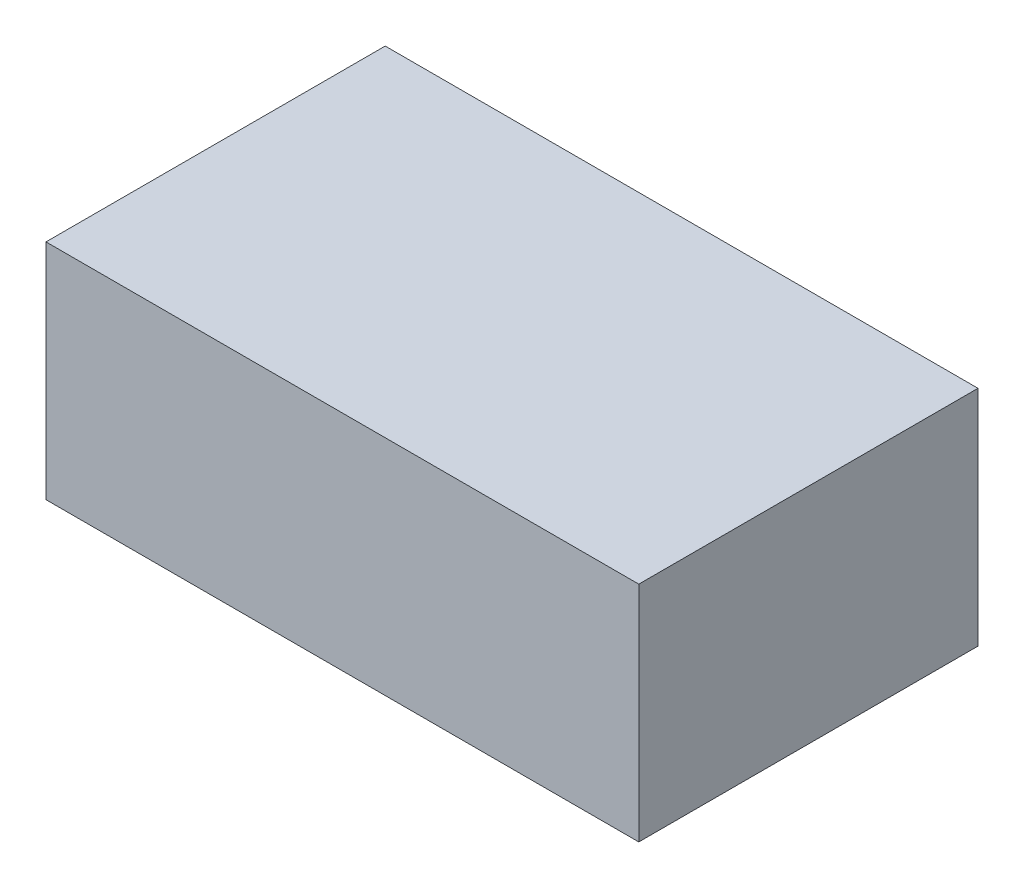
from build123d import *

# Parameters (mm, degrees)
SKETCH1_W           = 45.72
SKETCH1_H           = 26.162
BOSS_EXTRUDE1_DEPTH = 17.2212


with BuildPart() as part:
    # Sketch1 → Boss-Extrude1 (new body)
    with BuildSketch(Plane(origin=(0, 0, 0), x_dir=(1, 0, 0), z_dir=(0, 1, 0))):
        with Locations((22.86, -13.081)):
            Rectangle(SKETCH1_W, SKETCH1_H)
    extrude(amount=BOSS_EXTRUDE1_DEPTH)


solid = part.part
